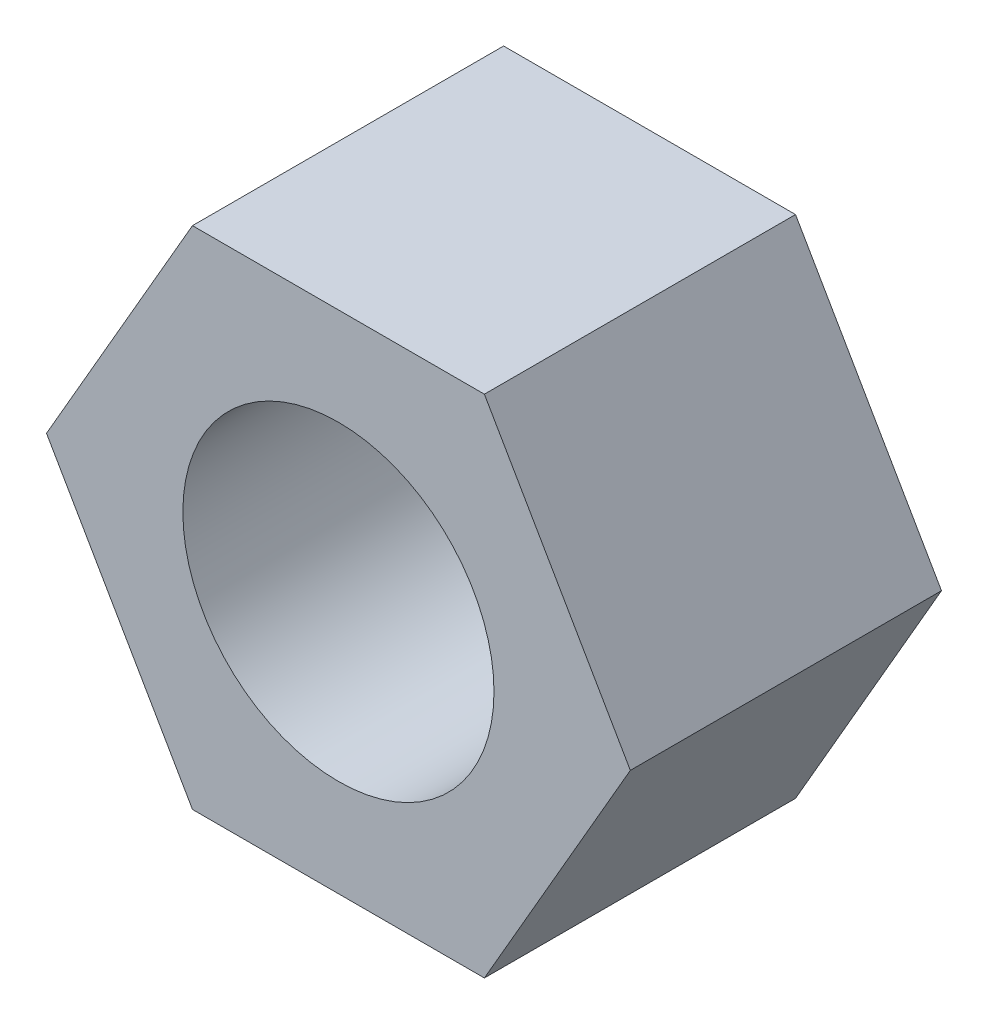
from build123d import *

# Parameters (mm, degrees)
SKETCH_1_R      = 4
EXTRUDE_4_DEPTH = 8


with BuildPart() as part:
    # Эскиз1 → Гайка_М4 (new body)
    with BuildSketch(Plane.XY):
        Polygon((-3.75277675, 6.5), (-7.505553499, 0), (-3.75277675, -6.5), (3.75277675, -6.5), (7.505553499, 0), (3.75277675, 6.5), align=None)
        Circle(SKETCH_1_R, mode=Mode.SUBTRACT)
    extrude(amount=EXTRUDE_4_DEPTH)


solid = part.part
